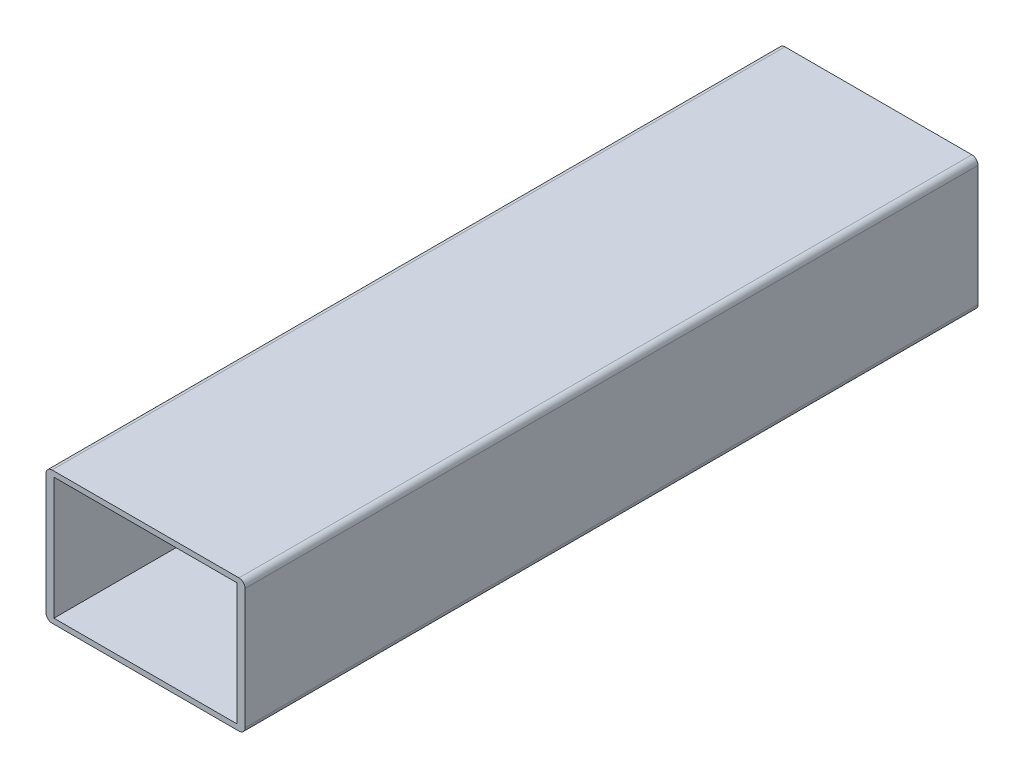
from build123d import *

# Parameters (mm, degrees)
SKETCH1_W           = 38.1
SKETCH1_H           = 25.4
BOSS_EXTRUDE1_DEPTH = 152.4


with BuildPart() as part:
    # Sketch1 → Boss-Extrude1 (new body)
    with BuildSketch(Plane.XY):
        with BuildLine():
            Line((19.431, -13.800666667), (-19.431, -13.800666667))
            ThreePointArc((-19.431, -13.800666667), (-20.329025612, -13.428692279), (-20.701, -12.530666667))
            Line((-20.701, -12.530666667), (-20.701, 12.530666667))
            ThreePointArc((-20.701, 12.530666667), (-20.329025612, 13.428692279), (-19.431, 13.800666667))
            Line((-19.431, 13.800666667), (19.431, 13.800666667))
            ThreePointArc((19.431, 13.800666667), (20.329025612, 13.428692279), (20.701, 12.530666667))
            Line((20.701, 12.530666667), (20.701, -12.530666667))
            ThreePointArc((20.701, -12.530666667), (20.329025612, -13.428692279), (19.431, -13.800666667))
        make_face()
        Rectangle(SKETCH1_W, SKETCH1_H, mode=Mode.SUBTRACT)
    extrude(amount=BOSS_EXTRUDE1_DEPTH)


solid = part.part
